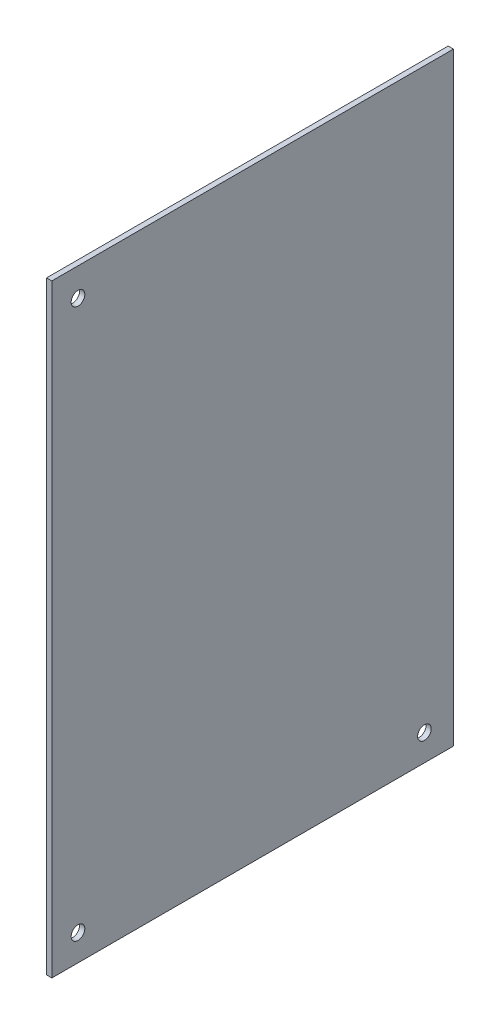
from build123d import *

# Parameters (mm, degrees)
SKICA1_W                 = 153
SKICA1_H                 = 230
P_IDAT_VYSUNUT_M1_DEPTH  = 2
SKICA2_R                 = 2.6
ODEBRAT_VYSUNUT_M1_DEPTH = 2


with BuildPart() as part:
    # Skica1 → Přidat vysunutím1 (new body)
    with BuildSketch(Plane(origin=(0, 0, 0), x_dir=(0, 0, -1), z_dir=(1, 0, 0))):
        Rectangle(SKICA1_W, SKICA1_H)
    extrude(amount=P_IDAT_VYSUNUT_M1_DEPTH)

    # Skica2 → Odebrat vysunutím1 (cut)
    with BuildSketch(Plane(origin=(2, 0, 0), x_dir=(0, 0, -1), z_dir=(1, 0, 0))):
        with Locations((65.45, -105)):
            Circle(SKICA2_R)
        with Locations((-66.530868554, -105)):
            Circle(SKICA2_R)
        with Locations((-66.530868554, 104.288337883)):
            Circle(SKICA2_R)
    extrude(amount=-ODEBRAT_VYSUNUT_M1_DEPTH, mode=Mode.SUBTRACT)


solid = part.part
